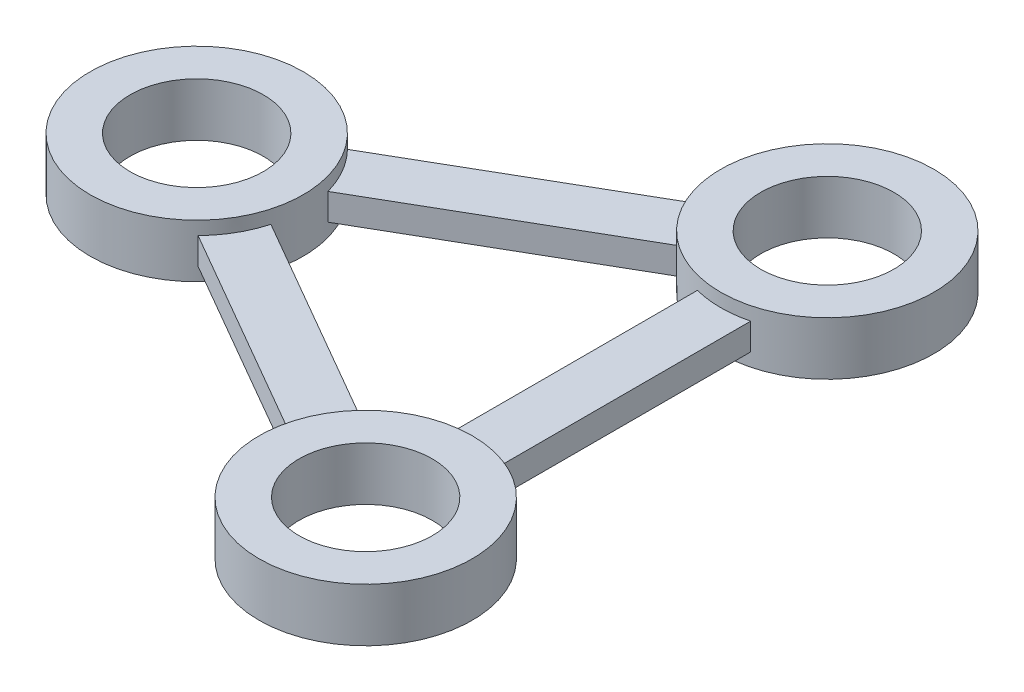
from build123d import *

# Parameters (mm, degrees)
BOSS_EXTRUDE1_DEPTH        = 10
BOSS_EXTRUDE1_DEPTH_BACK   = 10
SKETCH1_R                  = 40
SKETCH1_R_2                = 25
BOSS_EXTRUDE1_2_DEPTH      = 10
BOSS_EXTRUDE1_2_DEPTH_BACK = 10
BOSS_EXTRUDE1_3_DEPTH      = 10
BOSS_EXTRUDE1_3_DEPTH_BACK = 10
BOSS_EXTRUDE2_DEPTH        = 5
BOSS_EXTRUDE2_DEPTH_BACK   = 5


with BuildPart() as part:
    # Sketch1 → Boss-Extrude1 (new, two sides: drawn at the far end of the back side and taken through both)
    with BuildSketch(Plane(origin=(0, 0, 0), x_dir=(1, 0, 0), z_dir=(0, 1, 0)).offset(-BOSS_EXTRUDE1_DEPTH_BACK)):
        with Locations((-150, 0)):
            Circle(SKETCH1_R)
        with Locations((-150, 0)):
            Circle(SKETCH1_R_2, mode=Mode.SUBTRACT)
    extrude(amount=BOSS_EXTRUDE1_DEPTH + BOSS_EXTRUDE1_DEPTH_BACK)



with BuildPart() as body_2:
    # Sketch1 → Boss-Extrude1 2 (new, two sides: drawn at the far end of the back side and taken through both)
    with BuildSketch(Plane(origin=(0, 0, 0), x_dir=(1, 0, 0), z_dir=(0, 1, 0)).offset(-BOSS_EXTRUDE1_2_DEPTH_BACK)):
        with Locations((0, 86.6)):
            Circle(SKETCH1_R)
        with Locations((0, 86.6)):
            Circle(SKETCH1_R_2, mode=Mode.SUBTRACT)
    extrude(amount=BOSS_EXTRUDE1_2_DEPTH + BOSS_EXTRUDE1_2_DEPTH_BACK)


with BuildPart() as body_3:
    # Sketch1 → Boss-Extrude1 3 (new, two sides: drawn at the far end of the back side and taken through both)
    with BuildSketch(Plane(origin=(0, 0, 0), x_dir=(1, 0, 0), z_dir=(0, 1, 0)).offset(-BOSS_EXTRUDE1_3_DEPTH_BACK)):
        with Locations((0, -86.6)):
            Circle(SKETCH1_R)
        with Locations((0, -86.6)):
            Circle(SKETCH1_R_2, mode=Mode.SUBTRACT)
    extrude(amount=BOSS_EXTRUDE1_3_DEPTH + BOSS_EXTRUDE1_3_DEPTH_BACK)


with BuildPart() as part_1:
    add(part.part)

    add(body_2.part)  # Boss-Extrude2 merges body 2

    add(body_3.part)  # Boss-Extrude2 merges body 3
    # Sketch2 → Boss-Extrude2 (add, two sides: drawn at the far end of the back side and taken through both)
    with BuildSketch(Plane(origin=(0, 0, 0), x_dir=(1, 0, 0), z_dir=(0, 1, 0)).offset(-BOSS_EXTRUDE2_DEPTH_BACK)):
        with BuildLine():
            Line((10, 47.870166538), (10, -47.870166538))
            ThreePointArc((10, -47.870166538), (0, -46.6), (-10, -47.870166538))
            Line((-10, -47.870166538), (-10, 47.870166538))
            ThreePointArc((-10, 47.870166538), (0, 46.6), (10, 47.870166538))
        make_face()
        with BuildLine():
            Line((-111.45884437, 10.704173145), (-28.541375636, 58.575191761))
            ThreePointArc((-28.541375636, 58.575191761), (-34.641270188, 66.600440011), (-38.54115563, 75.895826855))
            Line((-38.54115563, 75.895826855), (-121.458624364, 28.024808239))
            ThreePointArc((-121.458624364, 28.024808239), (-115.358729812, 19.999559989), (-111.45884437, 10.704173145))
        make_face()
        with BuildLine():
            Line((-111.45884437, -10.704173145), (-28.541375636, -58.575191761))
            ThreePointArc((-28.541375636, -58.575191761), (-34.641270188, -66.600440011), (-38.54115563, -75.895826855))
            Line((-38.54115563, -75.895826855), (-121.458624364, -28.024808239))
            ThreePointArc((-121.458624364, -28.024808239), (-115.358729812, -19.999559989), (-111.45884437, -10.704173145))
        make_face()
    extrude(amount=BOSS_EXTRUDE2_DEPTH + BOSS_EXTRUDE2_DEPTH_BACK)


solid = part_1.part
